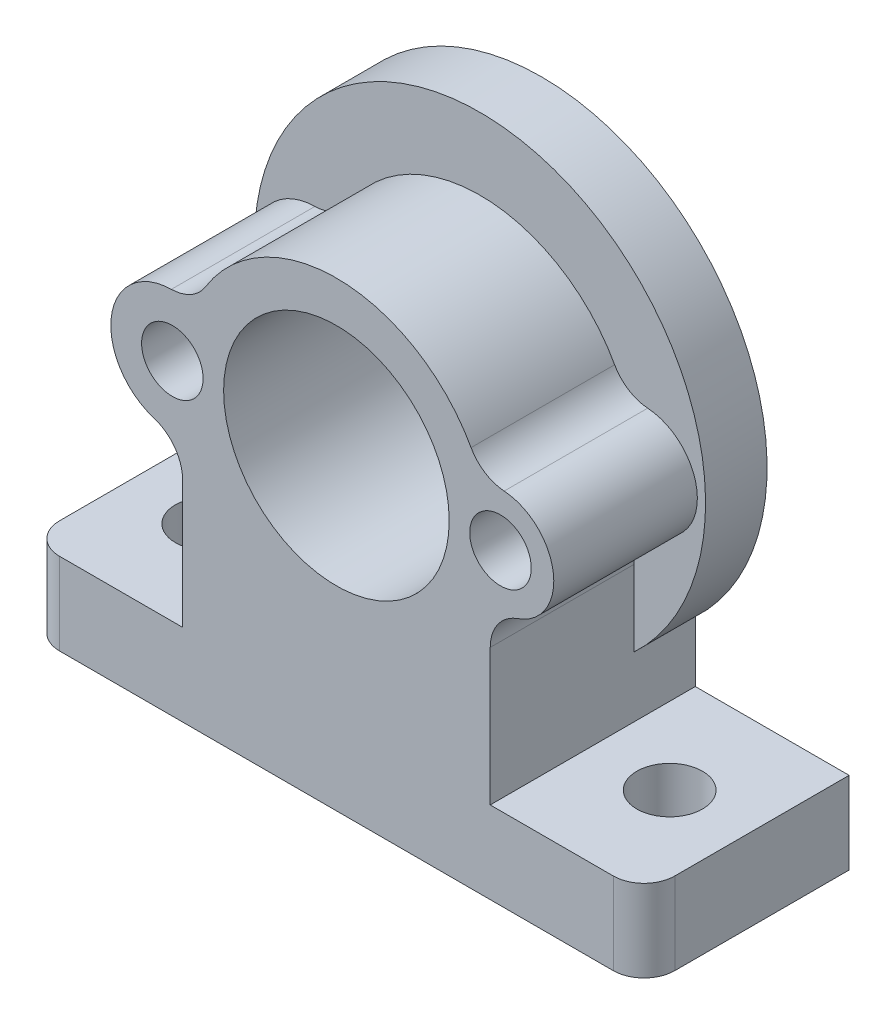
from build123d import *
from build123d.topology import SkipClean

# Parameters (mm, degrees)
SKETCH1_W           = 7.5
SKETCH1_H           = 4
SKETCH1_W_2         = 15
BOSS_EXTRUDE1_DEPTH = 10
SKETCH2_R           = 1.6
CUT_EXTRUDE1_DEPTH  = 26.831182706
SKETCH3_R           = 11
SKETCH3_R_2         = 5.5
BOSS_EXTRUDE2_DEPTH = 3
SKETCH4_R           = 1.5
CUT_EXTRUDE2_DEPTH  = 24.452078799
BOSS_EXTRUDE3_REACH = 25.452
FILLET1_R           = 2
FILLET2_R           = 1.5


with BuildPart() as part:
    # Sketch1 → Boss-Extrude1 (new body)
    with BuildSketch(Plane.XY):
        with Locations((11.25, -13)):
            Rectangle(SKETCH1_W, SKETCH1_H)
        with Locations((0, -13)):
            Rectangle(SKETCH1_W_2, SKETCH1_H)
        with BuildLine():
            Line((-7.5, -11), (7.5, -11))
            Line((7.5, -11), (7.5, 0))
            ThreePointArc((7.5, 0), (0, -7.5), (-7.5, 0))
            Line((-7.5, 0), (-7.5, -11))
        make_face()
        with Locations((-11.25, -13)):
            Rectangle(SKETCH1_W, SKETCH1_H)
        with BuildLine():
            ThreePointArc((-7.5, 0), (0, -7.5), (7.5, 0))
            Line((7.5, 0), (5.5, 0))
            ThreePointArc((5.5, 0), (0, -5.5), (-5.5, 0))
            Line((-5.5, 0), (-7.5, 0))
        make_face()
        with BuildLine():
            Line((5.5, 0), (7.5, 0))
            ThreePointArc((7.5, 0), (0, 7.5), (-7.5, 0))
            Line((-7.5, 0), (-5.5, 0))
            ThreePointArc((-5.5, 0), (0, 5.5), (5.5, 0))
        make_face()
        with BuildLine():
            ThreePointArc((-7.5, 0), (0, -7.5), (7.5, 0))
            Line((7.5, 0), (5.5, 0))
            ThreePointArc((5.5, 0), (0, -5.5), (-5.5, 0))
            Line((-5.5, 0), (-7.5, 0))
        make_face()
        with BuildLine():
            Line((5.5, 0), (7.5, 0))
            ThreePointArc((7.5, 0), (0, 7.5), (-7.5, 0))
            Line((-7.5, 0), (-5.5, 0))
            ThreePointArc((-5.5, 0), (0, 5.5), (5.5, 0))
        make_face()
    extrude(amount=BOSS_EXTRUDE1_DEPTH)

    # Sketch2 → Cut-Extrude1 (cut, through all)
    with BuildSketch(Plane(origin=(0, -11, 0), x_dir=(1, 0, 0), z_dir=(0, 1, 0))):
        with Locations(Location((-11.25, -5, 0), (0, 0, 270))):
            Circle(SKETCH2_R)
        with Locations(Location((11.25, -5, 0), (0, 0, 270))):
            Circle(SKETCH2_R)
    extrude(amount=-CUT_EXTRUDE1_DEPTH, mode=Mode.SUBTRACT)

    # Sketch3 → Boss-Extrude2 (add)
    with BuildSketch(Plane(origin=(0, 0, 0), x_dir=(-1, 0, 0), z_dir=(0, 0, -1))):
        Circle(SKETCH3_R)
        with Locations(Location((0, 0, 0), (0, 0, 180))):
            Circle(SKETCH3_R_2, mode=Mode.SUBTRACT)
    extrude(amount=-BOSS_EXTRUDE2_DEPTH)

    # Sketch4 → Cut-Extrude2 (cut, through all)
    with BuildSketch(Plane(origin=(0, 0, 0), x_dir=(-1, 0, 0), z_dir=(0, 0, -1))):
        with Locations((8, 0)):
            Circle(SKETCH4_R)
        with Locations(Location((-8, 0, 0), (0, 0, 65.375681648))):
            Circle(SKETCH4_R)
    extrude(amount=-CUT_EXTRUDE2_DEPTH, mode=Mode.SUBTRACT)

    # Sketch5 → Boss-Extrude3 (add, up to next)
    with BuildSketch(Plane.XY.offset(10), mode=Mode.PRIVATE) as boss_extrude3_sk1:
        with BuildLine():
            ThreePointArc((-7.375, 1.363589014), (-7.200544516, 2.098132188), (-6.953125, 2.811414721))
            ThreePointArc((-6.953125, 2.811414721), (-10.986612998, 0.28309504), (-7.5, -2.958039892))
            Line((-7.5, -2.958039892), (-7.5, -1.414213562))
            ThreePointArc((-7.5, -1.414213562), (-9.49848358, 0.067431159), (-7.375, 1.363589014))
        make_face()
    boss_extrude3_tool1 = extrude(boss_extrude3_sk1.sketch, amount=-BOSS_EXTRUDE3_REACH, mode=Mode.PRIVATE) - part.part
    # Sketch5 → Boss-Extrude3 (add, up to next)
    with BuildSketch(Plane.XY.offset(10), mode=Mode.PRIVATE) as boss_extrude3_sk2:
        with BuildLine():
            ThreePointArc((7.5, -2.551470164), (9.652271164, -2.00748599), (10.6, 0))
            ThreePointArc((10.6, 0), (9.483597823, 2.135166855), (7.093125, 2.436714537))
            ThreePointArc((7.093125, 2.436714537), (7.253934095, 1.905371394), (7.375, 1.363589014))
            ThreePointArc((7.375, 1.363589014), (8.810092587, 1.262438117), (9.5, 0))
            ThreePointArc((9.5, 0), (8.866025404, -1.224744871), (7.5, -1.414213562))
            Line((7.5, -1.414213562), (7.5, -2.551470164))
        make_face()
    boss_extrude3_tool2 = extrude(boss_extrude3_sk2.sketch, amount=-BOSS_EXTRUDE3_REACH, mode=Mode.PRIVATE) - part.part
    add(boss_extrude3_tool1.solids().sort_by_distance((-10.914564, 0.276266, 10))[0])
    add(boss_extrude3_tool2.solids().sort_by_distance((9.612413, -1.959059, 10))[0])

    # Fillet1
    fillet1_edges = [part.edges().sort_by_distance(p)[0] for p in [
        (7.093125, 2.436714537, 6.5),
        (7.5, -2.551470164, 6.5),
        (-7.5, -2.958039892, 6.5),
        (-6.953125, 2.811414721, 6.5),
    ]]
    fillet(fillet1_edges, radius=FILLET1_R)

    # Fillet2
    fillet2_edges = [part.edges().sort_by_distance(p)[0] for p in [
        (-15, -13, 10),
        (15, -13, 10),
    ]]
    fillet(fillet2_edges, radius=FILLET2_R)


solid = part.part
